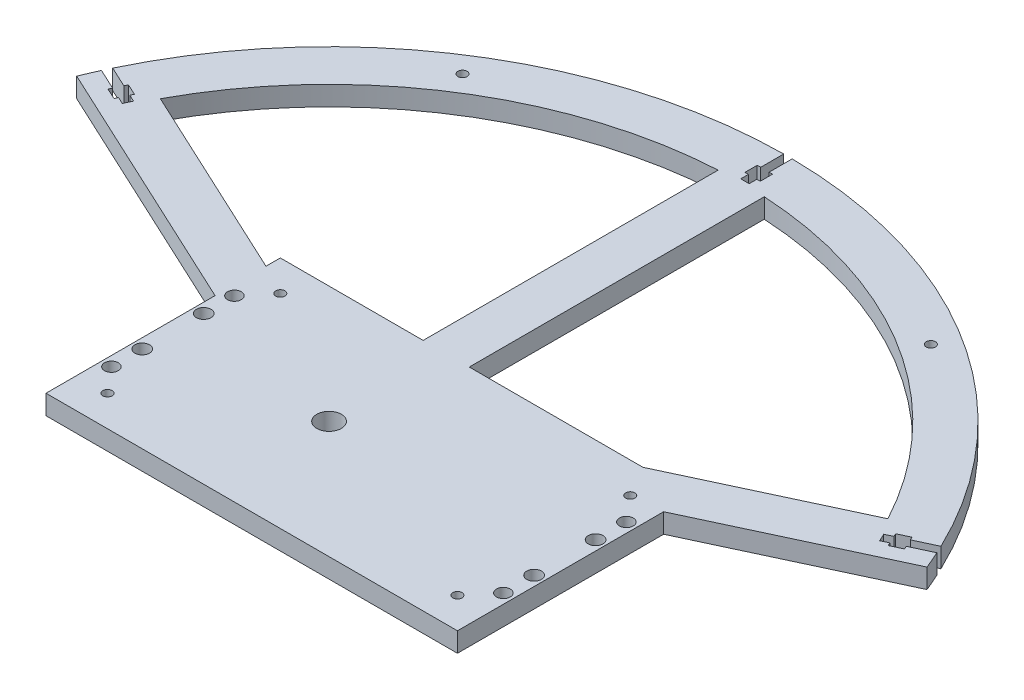
from build123d import *

# Parameters (mm, degrees)
BOSS_EXTRUDE1_DEPTH             = 3.175
SKETCH2_W                       = 2.75
SKETCH2_H                       = 2.5
SKETCH2_H_2                     = 4
SKETCH2_W_2                     = 1.125
SKETCH2_H_3                     = 7.5
CUT_EXTRUDE1_DEPTH              = 204.460831631
CIRPATTERN1_COUNT               = 2
CIRPATTERN1_ANGLE               = 65
CIRPATTERN1_THE_OTHER_WAY_COUNT = 2
CIRPATTERN1_THE_OTHER_WAY_ANGLE = 65
F_3_0_3_DIAMETER_HOLE1_D        = 3
F_8_0_8_DIAMETER_HOLE1_D        = 8
F_8_0_8_DIAMETER_HOLE1_DEPTH    = 6.35
F_8_CLEARANCE_HOLE1_D           = 4.4958
F_8_CLEARANCE_HOLE1_DEPTH       = 12.83
F_8_CLEARANCE_HOLE1_TIP         = 1.350674586
F_3_16_0_1875_DOWEL_HOLE1_D     = 4.7625
F_3_16_0_1875_DOWEL_HOLE1_DEPTH = 12.83
F_3_16_0_1875_DOWEL_HOLE1_TIP   = 1.430799349


with BuildPart() as part:
    # Sketch1 → Boss-Extrude1 (new, symmetric)
    with BuildSketch(Plane(origin=(0, 0, 0), x_dir=(1, 0, 0), z_dir=(0, 1, 0))):
        with BuildLine():
            Line((79.85, 28.959332111), (138.254290129, 56.193699868))
            ThreePointArc((138.254290129, 56.193699868), (0, 149.238), (-138.254290129, 56.193699868))
            Line((-138.254290129, 56.193699868), (-53.95, 16.881963765))
            Line((-53.95, 16.881963765), (-53.95, -38.1))
            Line((-53.95, -38.1), (79.85, -38.1))
            Line((79.85, -38.1), (79.85, 28.959332111))
        make_face()
        with BuildLine():
            Line((-7.5, 11.821590418), (-7.5, 11.772641828))
            Line((-7.5, 11.772641828), (-7.544362488, 11.793328396))
            ThreePointArc((-7.544362488, 11.793328396), (-7.522194517, 11.807480241), (-7.5, 11.821590418))
        make_face(mode=Mode.SUBTRACT)
        with BuildLine():
            ThreePointArc((7.5, 11.821590418), (7.522194517, 11.807480241), (7.544362488, 11.793328396))
            Line((7.544362488, 11.793328396), (7.5, 11.772641828))
            Line((7.5, 11.772641828), (7.5, 11.821590418))
        make_face(mode=Mode.SUBTRACT)
        with BuildLine():
            Line((-7.5, 134.028320306), (-7.5, 38.1))
            Line((-7.5, 38.1), (-53.95, 38.1))
            Line((-53.95, 38.1), (-53.95, 33.43263255))
            Line((-53.95, 33.43263255), (-118.301273414, 63.440124154))
            ThreePointArc((-118.301273414, 63.440124154), (-72.126024825, 113.215180903), (-7.5, 134.028320306))
        make_face(mode=Mode.SUBTRACT)
        with BuildLine():
            ThreePointArc((7.5, 134.028320306), (72.126024825, 113.215180903), (118.301273414, 63.440124154))
            Line((118.301273414, 63.440124154), (63.959201798, 38.1))
            Line((63.959201798, 38.1), (7.5, 38.1))
            Line((7.5, 38.1), (7.5, 134.028320306))
        make_face(mode=Mode.SUBTRACT)
    extrude(amount=BOSS_EXTRUDE1_DEPTH, both=True)

    # Sketch2 → Cut-Extrude1 (cut, symmetric)
    with BuildSketch(Plane(origin=(0, 0, 0), x_dir=(1, 0, 0), z_dir=(0, 1, 0))):
        with Locations((0, 136.488)):
            Rectangle(SKETCH2_W, SKETCH2_H)
        with Locations((0, 139.738)):
            Rectangle(SKETCH2_W, SKETCH2_H_2)
        with Locations((1.9375, 139.738)):
            Rectangle(SKETCH2_W_2, SKETCH2_H_2)
        with Locations((0, 145.488)):
            Rectangle(SKETCH2_W, SKETCH2_H_3)
        with Locations((-1.9375, 139.738)):
            Rectangle(SKETCH2_W_2, SKETCH2_H_2)
    cut_extrude1 = extrude(amount=CUT_EXTRUDE1_DEPTH, both=True, mode=Mode.SUBTRACT)

    # CirPattern1: Cut-Extrude1 ×2 about axis
    cirpattern1_axis = Axis((0, 0, 0), (0, 1, 0))
    for i in range(1, CIRPATTERN1_COUNT):
        add(cut_extrude1.rotate(cirpattern1_axis, i * CIRPATTERN1_ANGLE / (CIRPATTERN1_COUNT - 1)), mode=Mode.SUBTRACT)

    # CirPattern1 the other way: Cut-Extrude1 ×2 about axis
    cirpattern1_the_other_way_axis = Axis((0, 0, 0), (0, -1, 0))
    for i in range(1, CIRPATTERN1_THE_OTHER_WAY_COUNT):
        add(cut_extrude1.rotate(cirpattern1_the_other_way_axis, i * CIRPATTERN1_THE_OTHER_WAY_ANGLE / (CIRPATTERN1_THE_OTHER_WAY_COUNT - 1)), mode=Mode.SUBTRACT)

    # Ø3.0 (3) Diameter Hole1 (through all)
    with Locations(Plane(origin=(0, 3.175, 0), x_dir=(1, 0, 0), z_dir=(0, 1, 0))):
        with Locations((0, 0), (-76.155771888, 119.540616747), (76.155771888, 119.540616747), (69.85, 28.1), (69.85, -28.1), (-43.95, -28.1), (-43.95, 28.1)):
            Hole(F_3_0_3_DIAMETER_HOLE1_D / 2)

    # Ø8.0 (8) Diameter Hole1
    with Locations(Plane(origin=(0, 3.175, 0), x_dir=(1, 0, 0), z_dir=(0, 1, 0))):
        with Locations((0, 0)):
            Hole(F_8_0_8_DIAMETER_HOLE1_D / 2, depth=F_8_0_8_DIAMETER_HOLE1_DEPTH)

    # #8 Clearance Hole1
    with Locations(Plane(origin=(0, 3.175, 0), x_dir=(1, 0, 0), z_dir=(0, 1, 0))):
        with Locations((-50.775, -20), (-50.775, 20), (76.675, -20), (76.675, 20)):
            Hole(F_8_CLEARANCE_HOLE1_D / 2, depth=F_8_CLEARANCE_HOLE1_DEPTH)
            with Locations((0, 0, -(F_8_CLEARANCE_HOLE1_DEPTH + F_8_CLEARANCE_HOLE1_TIP / 2))):  # 118° drill point
                Cone(0, F_8_CLEARANCE_HOLE1_D / 2, F_8_CLEARANCE_HOLE1_TIP, mode=Mode.SUBTRACT)

    # 3/16 (0.1875) Dowel Hole1
    with Locations(Plane(origin=(0, 3.175, 0), x_dir=(1, 0, 0), z_dir=(0, 1, 0))):
        with Locations((-50.775, -10), (-50.775, 10), (76.675, -10), (76.675, 10)):
            Hole(F_3_16_0_1875_DOWEL_HOLE1_D / 2, depth=F_3_16_0_1875_DOWEL_HOLE1_DEPTH)
            with Locations((0, 0, -(F_3_16_0_1875_DOWEL_HOLE1_DEPTH + F_3_16_0_1875_DOWEL_HOLE1_TIP / 2))):  # 118° drill point
                Cone(0, F_3_16_0_1875_DOWEL_HOLE1_D / 2, F_3_16_0_1875_DOWEL_HOLE1_TIP, mode=Mode.SUBTRACT)


solid = part.part
